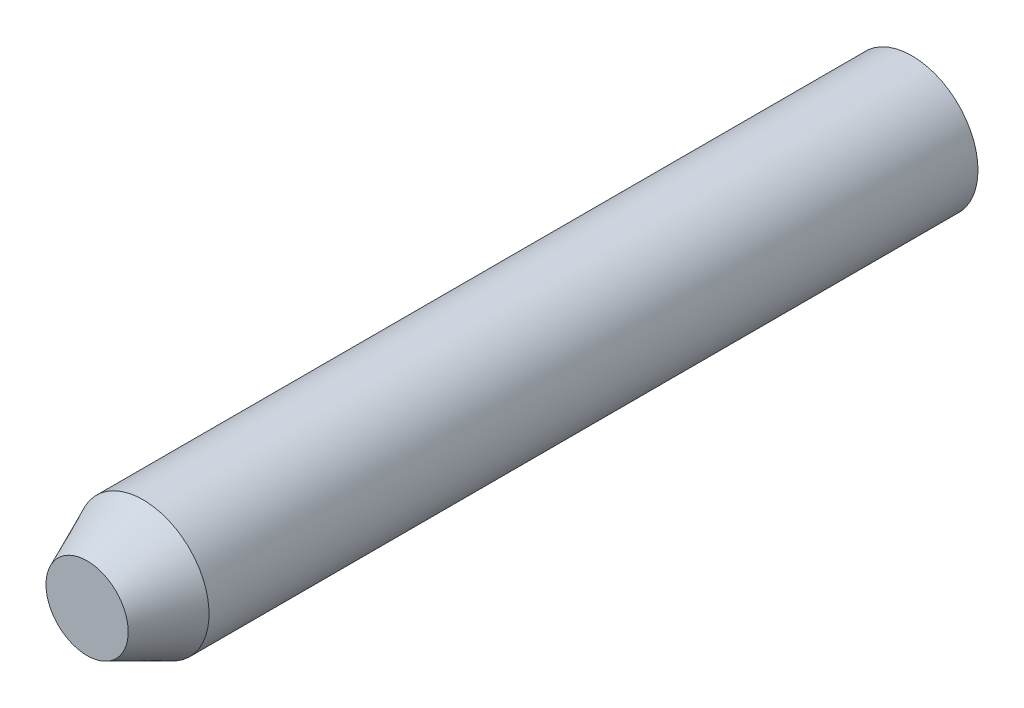
from build123d import *

# Parameters (mm, degrees)
SKETCH1_R           = 8
BOSS_EXTRUDE1_DEPTH = 100


with BuildPart() as part:
    # Sketch1 → Boss-Extrude1 (new body)
    with BuildSketch(Plane.XY):
        Circle(SKETCH1_R)
    extrude(amount=BOSS_EXTRUDE1_DEPTH)

    # Sketch2 → Cut-Revolve2 (revolve, cut)
    with BuildSketch(Plane(origin=(0, 0, 0), x_dir=(0, 0, -1), z_dir=(1, 0, 0)), mode=Mode.PRIVATE) as cut_revolve2_sk:
        Polygon((-100, 4.983080318), (-100, 8), (-93.214350596, 8), align=None)
    revolve(cut_revolve2_sk.sketch.rotate(Axis((0, 0, 100), (0, 0, 1)), 90), axis=Axis((0, 0, 100), (0, 0, 1)), mode=Mode.SUBTRACT)


solid = part.part
